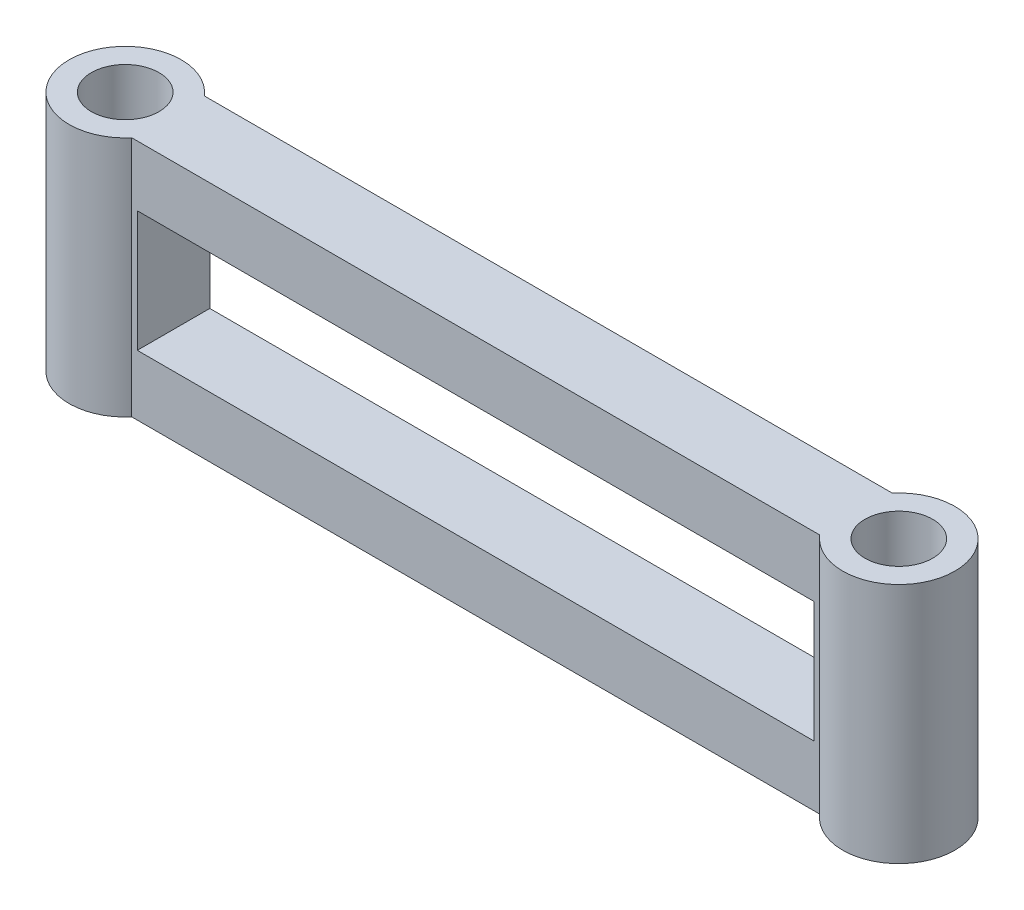
from build123d import *

# Parameters (mm, degrees)
SKETCH1_R           = 8.89
BOSS_EXTRUDE1_DEPTH = 63.5
SKETCH2_W           = 177.8
SKETCH2_H           = 31.75
CUT_EXTRUDE1_DEPTH  = 135.735987297


with BuildPart() as part:
    # Sketch1 → Boss-Extrude1 (new body)
    with BuildSketch(Plane(origin=(0, 0, 0), x_dir=(1, 0, 0), z_dir=(0, 1, 0))):
        with BuildLine():
            Line((-90.361396928, 59.02921057), (90.361396928, 59.02921057))
            ThreePointArc((90.361396928, 59.02921057), (116.332, 49.50421057), (90.361396928, 39.97921057))
            Line((90.361396928, 39.97921057), (-90.361396928, 39.97921057))
            ThreePointArc((-90.361396928, 39.97921057), (-116.332, 49.50421057), (-90.361396928, 59.02921057))
        make_face()
        with Locations(Location((101.6, 49.50421057, 0), (0, 0, 270))):
            Circle(SKETCH1_R, mode=Mode.SUBTRACT)
        with Locations(Location((-101.6, 49.50421057, 0), (0, 0, 270))):
            Circle(SKETCH1_R, mode=Mode.SUBTRACT)
    extrude(amount=BOSS_EXTRUDE1_DEPTH)

    # Sketch2 → Cut-Extrude1 (cut, through all)
    with BuildSketch(Plane.XY.offset(-39.97921057)):
        with Locations((0, 31.75)):
            Rectangle(SKETCH2_W, SKETCH2_H)
    extrude(amount=-CUT_EXTRUDE1_DEPTH, mode=Mode.SUBTRACT)


solid = part.part
